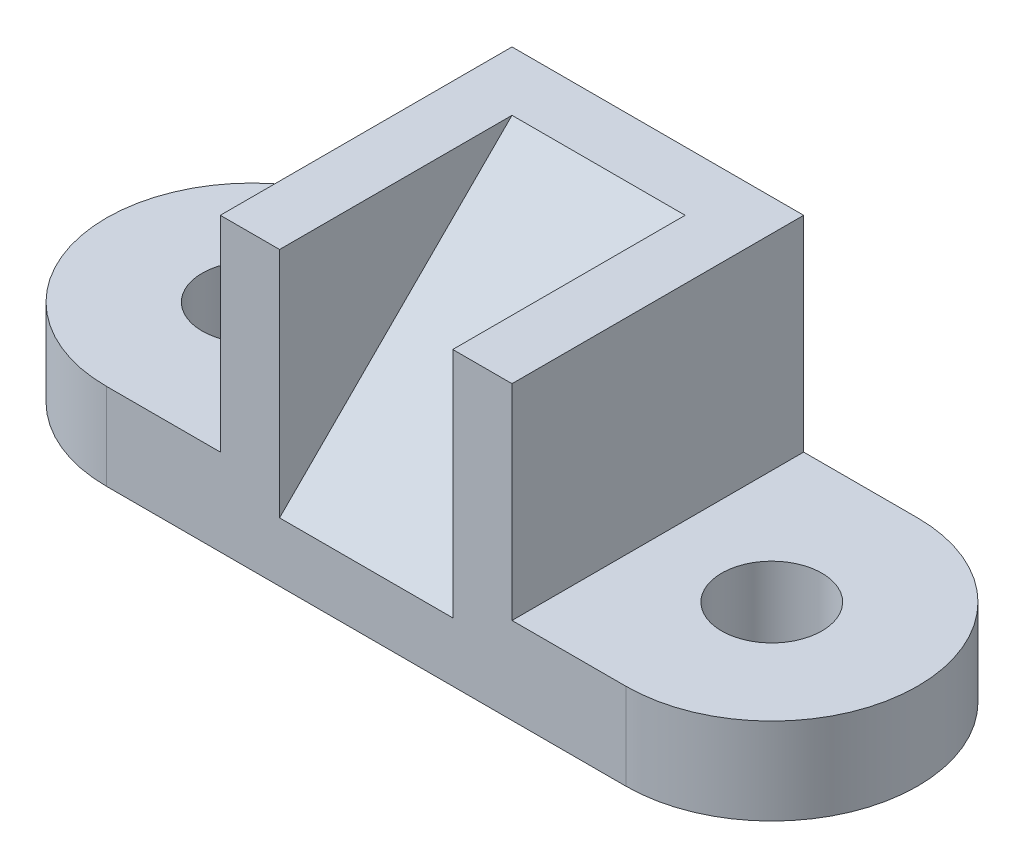
from build123d import *

# Parameters (mm, degrees)
SKETCH1_R           = 11
BOSS_EXTRUDE1_DEPTH = 19
SKETCH2_W           = 64
SKETCH2_H           = 64
BOSS_EXTRUDE2_DEPTH = 45
CUT_EXTRUDE1_START  = -13
CUT_EXTRUDE1_DEPTH  = 38


with BuildPart() as part:
    # Sketch1 → Boss-Extrude1 (new body)
    with BuildSketch(Plane(origin=(0, 0, 0), x_dir=(1, 0, 0), z_dir=(0, 1, 0))):
        with BuildLine():
            Line((-57, 32), (57, 32))
            ThreePointArc((57, 32), (89, 0), (57, -32))
            Line((57, -32), (-57, -32))
            ThreePointArc((-57, -32), (-89, 0), (-57, 32))
        make_face()
        with Locations(Location((57, 0, 0), (0, 0, 270))):
            Circle(SKETCH1_R, mode=Mode.SUBTRACT)
        with Locations(Location((-57, 0, 0), (0, 0, 270))):
            Circle(SKETCH1_R, mode=Mode.SUBTRACT)
    extrude(amount=BOSS_EXTRUDE1_DEPTH)

    # Sketch2 → Boss-Extrude2 (add)
    with BuildSketch(Plane(origin=(0, 19, 0), x_dir=(1, 0, 0), z_dir=(0, 1, 0))):
        Rectangle(SKETCH2_W, SKETCH2_H)
    extrude(amount=BOSS_EXTRUDE2_DEPTH)

    # Sketch3 → Cut-Extrude1 (cut)
    with BuildSketch(Plane.ZY.offset(32).offset(CUT_EXTRUDE1_START)):
        Polygon((32, 64), (-19, 64), (32, 13), align=None)
    extrude(amount=-CUT_EXTRUDE1_DEPTH, mode=Mode.SUBTRACT)


solid = part.part
